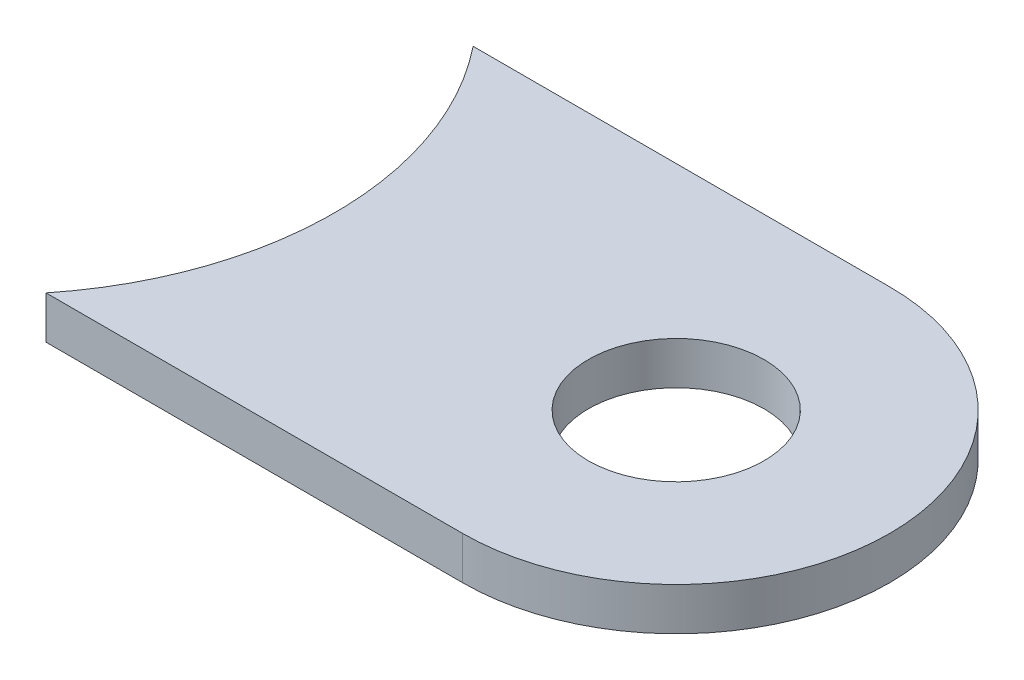
from build123d import *

# Parameters (mm, degrees)
SKETCH1_R           = 3.2639
BOSS_EXTRUDE1_DEPTH = 1.5875
SKETCH2_R           = 12.7
CUT_EXTRUDE1_DEPTH  = 27.658658303


with BuildPart() as part:
    # Sketch1 → Boss-Extrude1 (new body)
    with BuildSketch(Plane(origin=(0, 0, 0), x_dir=(1, 0, 0), z_dir=(0, 1, 0))):
        with BuildLine():
            Line((-25.4, 7.9375), (0, 7.9375))
            ThreePointArc((0, 7.9375), (7.9375, 0), (0, -7.9375))
            Line((0, -7.9375), (-25.4, -7.9375))
            Line((-25.4, -7.9375), (-25.4, 7.9375))
        make_face()
        with Locations(Location((0, 0, 0), (0, 0, 270))):
            Circle(SKETCH1_R, mode=Mode.SUBTRACT)
    extrude(amount=BOSS_EXTRUDE1_DEPTH)

    # Sketch2 → Cut-Extrude1 (cut, through all)
    with BuildSketch(Plane(origin=(0, 1.5875, 0), x_dir=(1, 0, 0), z_dir=(0, 1, 0))):
        with Locations((-25.4, 0)):
            Circle(SKETCH2_R)
    extrude(amount=-CUT_EXTRUDE1_DEPTH, mode=Mode.SUBTRACT)


solid = part.part
